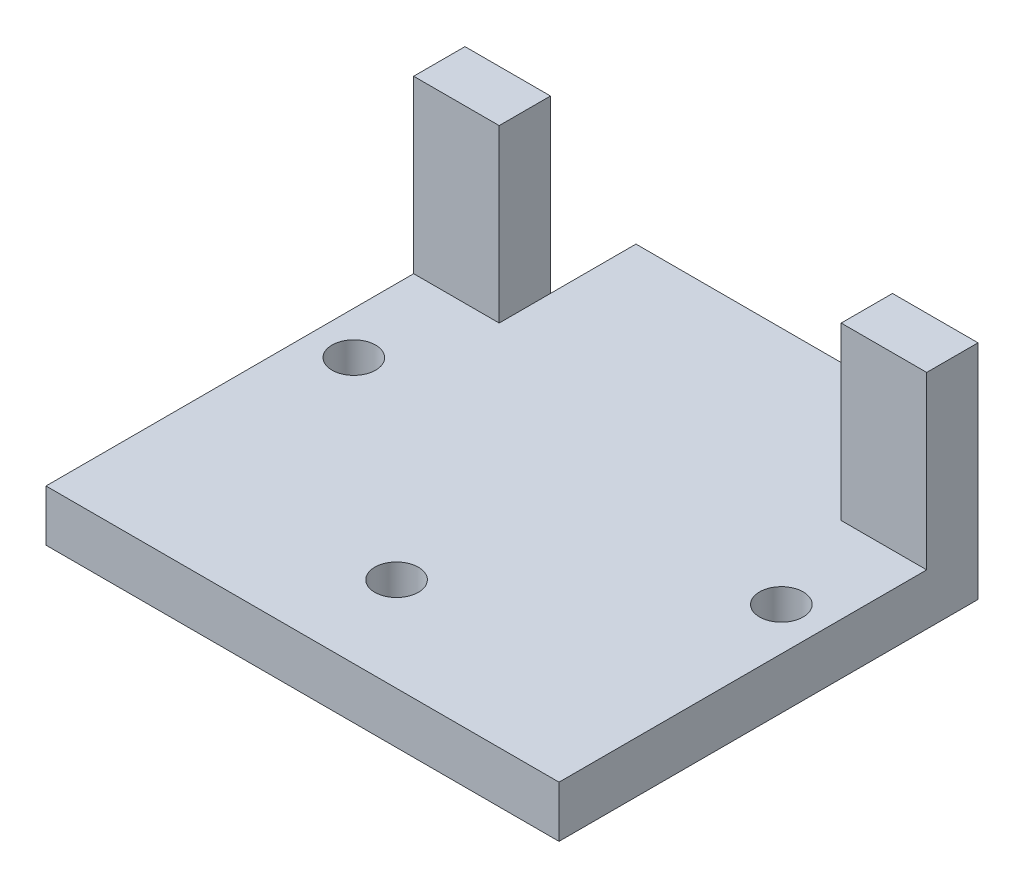
from build123d import *

# Parameters (mm, degrees)
SKETCH1_W           = 60
SKETCH1_H           = 80
BOSS_EXTRUDE1_DEPTH = 6
SKETCH2_R           = 2.55
CUT_EXTRUDE1_DEPTH  = 51.358713248
SKETCH3_W           = 10
SKETCH3_H           = 6
BOSS_EXTRUDE2_DEPTH = 20


with BuildPart() as part:
    # Sketch1 → Boss-Extrude1 (new body)
    with BuildSketch(Plane(origin=(0, 0, 0), x_dir=(1, 0, 0), z_dir=(0, 1, 0))):
        Rectangle(SKETCH1_W, SKETCH1_H)
    extrude(amount=BOSS_EXTRUDE1_DEPTH)

    # Sketch2 → Cut-Extrude1 (cut, through all)
    with BuildSketch(Plane(origin=(0, 6, 0), x_dir=(1, 0, 0), z_dir=(0, 1, 0))):
        with Locations(Location((25, -9, 0), (0, 0, 270))):
            Circle(SKETCH2_R)
        with Locations(Location((-25, -9, 0), (0, 0, 270))):
            Circle(SKETCH2_R)
        with Locations(Location((0, -29, 0), (0, 0, 270))):
            Circle(SKETCH2_R)
        Polygon((-38.891606185, 9), (-20, 9), (-20, 19), (20, 19), (20, 9), (37.945141675, 9), (37.945141675, 57.336722716), (-38.891606185, 57.336722716), align=None)
    extrude(amount=-CUT_EXTRUDE1_DEPTH, mode=Mode.SUBTRACT)

    # Sketch3 → Boss-Extrude2 (add)
    with BuildSketch(Plane(origin=(0, 6, 0), x_dir=(1, 0, 0), z_dir=(0, 1, 0))):
        with Locations((25, 6)):
            Rectangle(SKETCH3_W, SKETCH3_H)
        with Locations((-25, 6)):
            Rectangle(SKETCH3_W, SKETCH3_H)
    extrude(amount=BOSS_EXTRUDE2_DEPTH)


solid = part.part
